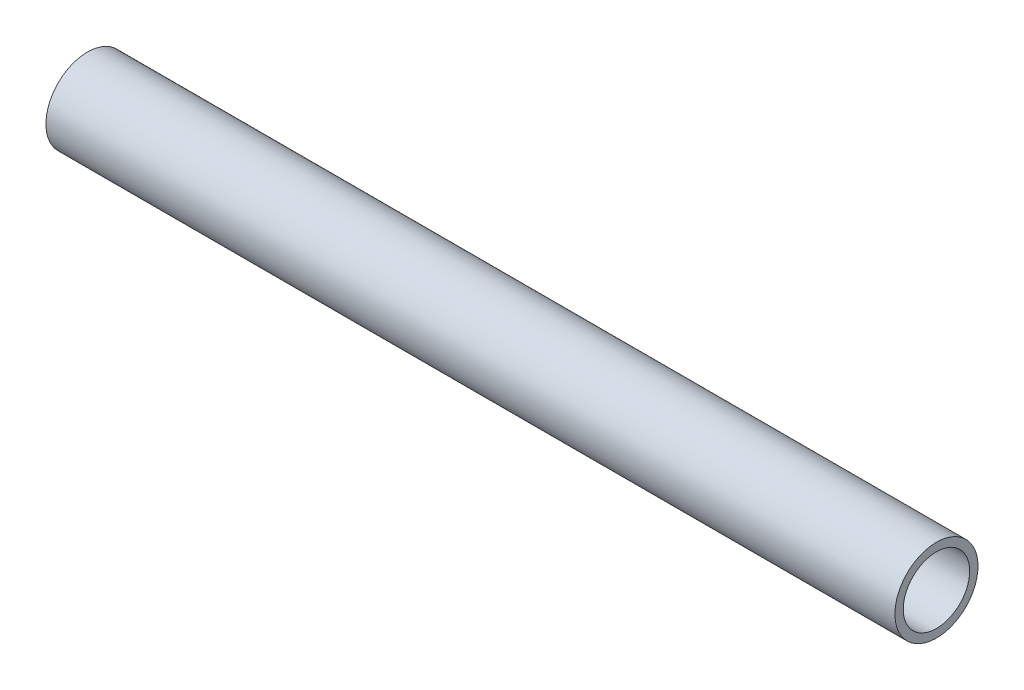
from build123d import *

# Parameters (mm, degrees)
SKETCH1_R           = 15.875
SKETCH1_R_2         = 12.7
EXTRUDE_THIN1_DEPTH = 162.243250062


with BuildPart() as part:
    # Sketch1 → Extrude-Thin1 (new, symmetric)
    with BuildSketch(Plane(origin=(0, 0, 0), x_dir=(0, 0, -1), z_dir=(1, 0, 0))):
        Circle(SKETCH1_R)
        Circle(SKETCH1_R_2, mode=Mode.SUBTRACT)
    extrude(amount=EXTRUDE_THIN1_DEPTH, both=True)


solid = part.part
